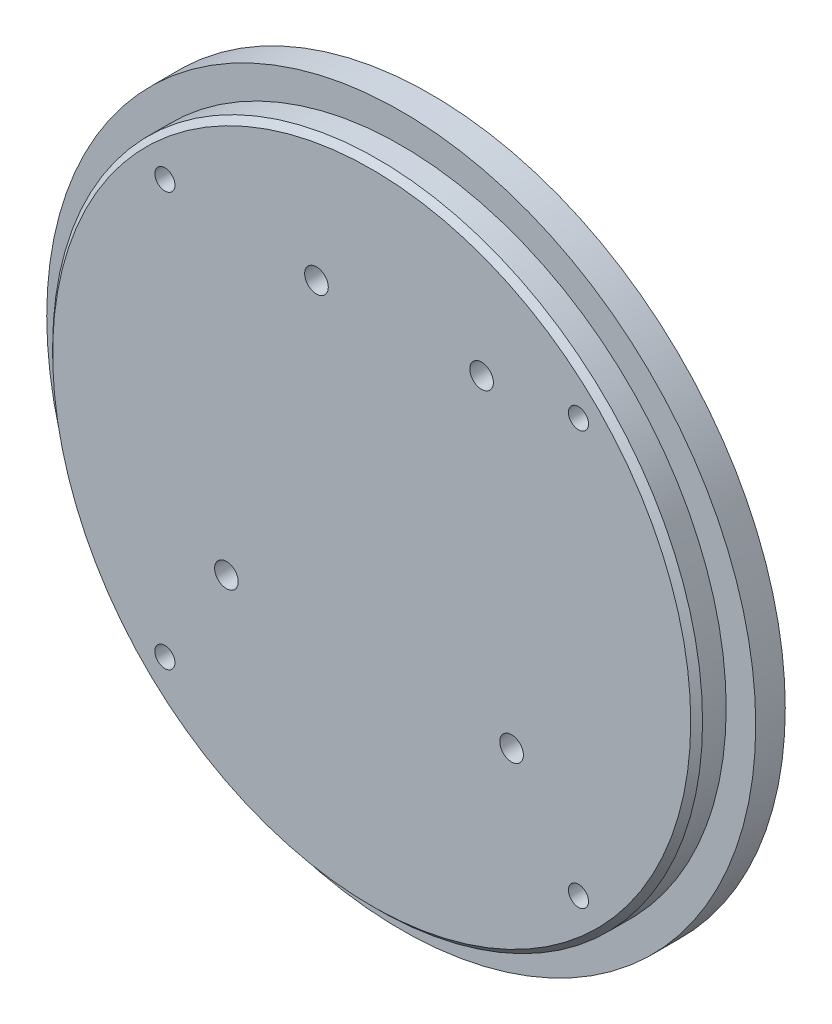
from build123d import *

# Parameters (mm, degrees)
SKETCH1_R                     = 55
BOSS_EXTRUDE1_DEPTH           = 10
SKETCH6_R                     = 50
BOSS_EXTRUDE3_DEPTH           = 5
SKETCH9_R                     = 2
CUT_EXTRUDE2_DEPTH            = 8
BOSS_EXTRUDE4_START           = -5
SKETCH24_R                    = 60
SKETCH24_R_2                  = 55
BOSS_EXTRUDE4_DEPTH           = 5
CBORE_FOR_M3_SHCS1_AT_2_COUNT = 2
CBORE_FOR_M3_SHCS1_AT_2_PITCH = 70
CBORE_FOR_M3_SHCS1_AT_3_COUNT = 2
CBORE_FOR_M3_SHCS1_AT_3_PITCH = 70
CBORE_FOR_M3_SHCS1_AT_4_COUNT = 2
CBORE_FOR_M3_SHCS1_AT_4_PITCH = 98.994949366
CHAMFER2_SIZE                 = 1


with BuildPart() as part:
    # Sketch1 → Boss-Extrude1 (new body)
    with BuildSketch(Plane.XY):
        Circle(SKETCH1_R)
    extrude(amount=-BOSS_EXTRUDE1_DEPTH)

    # Sketch6 → Boss-Extrude3 (add)
    with BuildSketch(Plane(origin=(0, 0, -10), x_dir=(-1, 0, 0), z_dir=(0, 0, -1))):
        Circle(SKETCH6_R)
    extrude(amount=-BOSS_EXTRUDE3_DEPTH)

    # Sketch9 → Cut-Extrude2 (cut)
    with BuildSketch(Plane.XY):
        with Locations((23.676144844, -19.05)):
            Circle(SKETCH9_R)
        with Locations((-24.583855156, -17.78)):
            Circle(SKETCH9_R)
        with Locations((18.596144844, 33.02)):
            Circle(SKETCH9_R)
        with Locations((-9.343855156, 33.02)):
            Circle(SKETCH9_R)
    extrude(amount=-CUT_EXTRUDE2_DEPTH, mode=Mode.SUBTRACT)

    # Sketch24 → Boss-Extrude4 (add)
    with BuildSketch(Plane(origin=(0, 0, -10), x_dir=(-1, 0, 0), z_dir=(0, 0, -1)).offset(BOSS_EXTRUDE4_START)):
        Circle(SKETCH24_R)
        with Locations(Location((0, 0, 0), (0, 0, 180))):
            Circle(SKETCH24_R_2, mode=Mode.SUBTRACT)
    extrude(amount=BOSS_EXTRUDE4_DEPTH)

    # Sketch26 → CBORE for M3 SHCS1 (revolve, cut)
    with BuildSketch(Plane(origin=(-35, -35, -10), x_dir=(0, 1, 0), z_dir=(1, 0, 0))):
        Polygon((0, 0), (0, 10), (1.7, 10), (1.7, 3), (3.25, 3), (3.25, 0.025), (3.275, 0), align=None)
    cbore_for_m3_shcs1 = revolve(axis=Axis((-35, -35, -16.35), (0, 0, 1)), mode=Mode.SUBTRACT)

    # CBORE for M3 SHCS1 at 2: CBORE for M3 SHCS1 ×2
    with Locations(*[(0, i * CBORE_FOR_M3_SHCS1_AT_2_PITCH, 0) for i in range(1, CBORE_FOR_M3_SHCS1_AT_2_COUNT)]):
        add(cbore_for_m3_shcs1, mode=Mode.SUBTRACT)

    # CBORE for M3 SHCS1 at 3: CBORE for M3 SHCS1 ×2
    with Locations(*[(i * CBORE_FOR_M3_SHCS1_AT_3_PITCH, 0, 0) for i in range(1, CBORE_FOR_M3_SHCS1_AT_3_COUNT)]):
        add(cbore_for_m3_shcs1, mode=Mode.SUBTRACT)

    # CBORE for M3 SHCS1 at 4: CBORE for M3 SHCS1 ×2
    with Locations(*[Vector(0.7071067811865476, 0.7071067811865476, 0) * (i * CBORE_FOR_M3_SHCS1_AT_4_PITCH) for i in range(1, CBORE_FOR_M3_SHCS1_AT_4_COUNT)]):
        add(cbore_for_m3_shcs1, mode=Mode.SUBTRACT)

    # Chamfer2
    chamfer2_edges = [part.edges().sort_by_distance(p)[0] for p in [
        (-55, 0, 0),
    ]]
    chamfer(chamfer2_edges, length=CHAMFER2_SIZE)


solid = part.part
